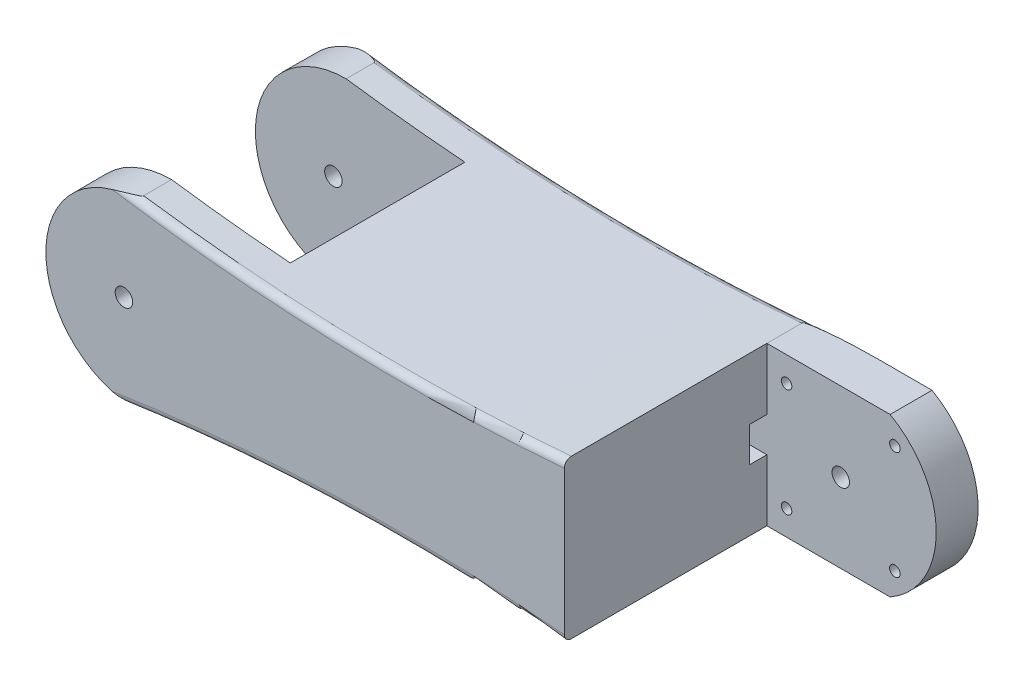
from build123d import *

# Parameters (mm, degrees)
SKETCH1_W               = 200
SKETCH1_H               = 70
BOSS_EXTRUDE1_DEPTH     = 55
SKETCH3_W               = 50
SKETCH3_H               = 55
CUT_EXTRUDE1_DEPTH      = 23
CUT_EXTRUDE2_DEPTH      = 134.88427839
CUT_EXTRUDE2_DEPTH_BACK = 134.88427839
SKETCH4_OUTSIDE_W       = 245.784
SKETCH4_OUTSIDE_H       = 100.784
FILLET2_R               = 2
CUT_EXTRUDE6_DEPTH      = 133.153320217
CUT_EXTRUDE6_DEPTH_BACK = 133.153320217
SKETCH11_R              = 2.5
SKETCH12_W              = 106.420184481
SKETCH12_H              = 81.22852992
CUT_EXTRUDE7_DEPTH      = 25
CUT_EXTRUDE8_DEPTH      = 127.208161551
CUT_EXTRUDE9_DEPTH      = 50
SKETCH15_R              = 2.5
SKETCH15_R_2            = 1.5
CUT_EXTRUDE10_DEPTH     = 50
SKETCH16_W              = 5
SKETCH16_H              = 10
CUT_EXTRUDE11_DEPTH     = 162.677147573


with BuildPart() as part:
    # Sketch1 → Boss-Extrude1 (new body)
    with BuildSketch(Plane(origin=(0, 0, 0), x_dir=(1, 0, 0), z_dir=(0, 1, 0))):
        Rectangle(SKETCH1_W, SKETCH1_H)
    extrude(amount=BOSS_EXTRUDE1_DEPTH)

    # Sketch3 → Cut-Extrude1 (cut, symmetric)
    with BuildSketch(Plane.XY):
        with Locations((75, 27.5)):
            Rectangle(SKETCH3_W, SKETCH3_H)
    extrude(amount=CUT_EXTRUDE1_DEPTH, both=True, mode=Mode.SUBTRACT)

    # Sketch4 outside → Cut-Extrude2 (cut, two sides: drawn at the far end of the back side and taken through both)
    with BuildSketch(Plane.XY.offset(35).offset(-CUT_EXTRUDE2_DEPTH_BACK)):
        with Locations((0, 27.5)):
            Rectangle(SKETCH4_OUTSIDE_W, SKETCH4_OUTSIDE_H)
        with BuildLine():
            ThreePointArc((-72.5, 53.5), (-98.5, 27.5), (-72.5, 1.5))
            ThreePointArc((-72.5, 1.5), (2.267755531, 6.809398073), (77.063073628, 1.90354792))
            ThreePointArc((77.063073628, 1.90354792), (98.5, 27.5), (77.063073628, 53.09645208))
            ThreePointArc((77.063073628, 53.09645208), (2.267755531, 48.190601927), (-72.5, 53.5))
        make_face(mode=Mode.SUBTRACT)
    extrude(amount=CUT_EXTRUDE2_DEPTH + CUT_EXTRUDE2_DEPTH_BACK, mode=Mode.SUBTRACT)

    # Fillet2
    fillet2_edges = [part.edges().sort_by_distance(p)[0] for p in [
        (2.267755531, 48.190601927, -35),
        (2.267755531, 6.809398073, -35),
        (2.267755531, 48.190601927, 35),
        (2.267755531, 6.809398073, 35),
    ]]
    fillet(fillet2_edges, radius=FILLET2_R)

    # Sketch11 → Cut-Extrude6 (cut, two sides: drawn at the far end of the back side and taken through both)
    with BuildSketch(Plane.XY.offset(35).offset(-CUT_EXTRUDE6_DEPTH_BACK)):
        with Locations((-76.15, 27.5)):
            Circle(SKETCH11_R)
    extrude(amount=CUT_EXTRUDE6_DEPTH + CUT_EXTRUDE6_DEPTH_BACK, mode=Mode.SUBTRACT)

    # Sketch12 → Cut-Extrude7 (cut, symmetric)
    with BuildSketch(Plane.XY):
        with Locations((-91.710092241, 25.80773896)):
            Rectangle(SKETCH12_W, SKETCH12_H)
    extrude(amount=CUT_EXTRUDE7_DEPTH, both=True, mode=Mode.SUBTRACT)

    # Sketch13 → Cut-Extrude8 (cut, through all)
    with BuildSketch(Plane(origin=(0, 0, 23), x_dir=(-1, 0, 0), z_dir=(0, 0, -1))):
        with BuildLine():
            Line((-50, 4.863495472), (-50, 50.136504528))
            ThreePointArc((-50, 50.136504528), (-63.549853932, 51.449003205), (-77.063073628, 53.09645208))
            ThreePointArc((-77.063073628, 53.09645208), (-98.5, 27.5), (-77.063073628, 1.90354792))
            ThreePointArc((-77.063073628, 1.90354792), (-63.549853932, 3.550996795), (-50, 4.863495472))
        make_face()
    extrude(amount=-CUT_EXTRUDE8_DEPTH, mode=Mode.SUBTRACT)

    # Sketch14 → Cut-Extrude9 (cut)
    with BuildSketch(Plane.XY.offset(-23)):
        Polygon((50, 4.863495472), (79.442513565, -11.304195271), (157.593662914, 0), (128.462884047, 83.234297684), (50, 50.136504528), (98.5, 50.136504528), (98.5, 4.863495472), align=None)
    extrude(amount=-CUT_EXTRUDE9_DEPTH, mode=Mode.SUBTRACT)

    # Sketch15 → Cut-Extrude10 (cut)
    with BuildSketch(Plane.XY.offset(-23)):
        with Locations((71.15, 27.5)):
            Circle(SKETCH15_R)
        with Locations((55.650219356, 42.999780644)):
            Circle(SKETCH15_R_2)
        with Locations((86.649780644, 42.999780644)):
            Circle(SKETCH15_R_2)
        with Locations((86.649780644, 12.000219356)):
            Circle(SKETCH15_R_2)
        with Locations((55.650219356, 12.000219356)):
            Circle(SKETCH15_R_2)
    extrude(amount=-CUT_EXTRUDE10_DEPTH, mode=Mode.SUBTRACT)

    # Sketch16 → Cut-Extrude11 (cut, through all)
    with BuildSketch(Plane(origin=(50, 0, 0), x_dir=(0, 0, -1), z_dir=(1, 0, 0))):
        with Locations((20.5, 27.5)):
            Rectangle(SKETCH16_W, SKETCH16_H)
    extrude(amount=-CUT_EXTRUDE11_DEPTH, mode=Mode.SUBTRACT)


solid = part.part
